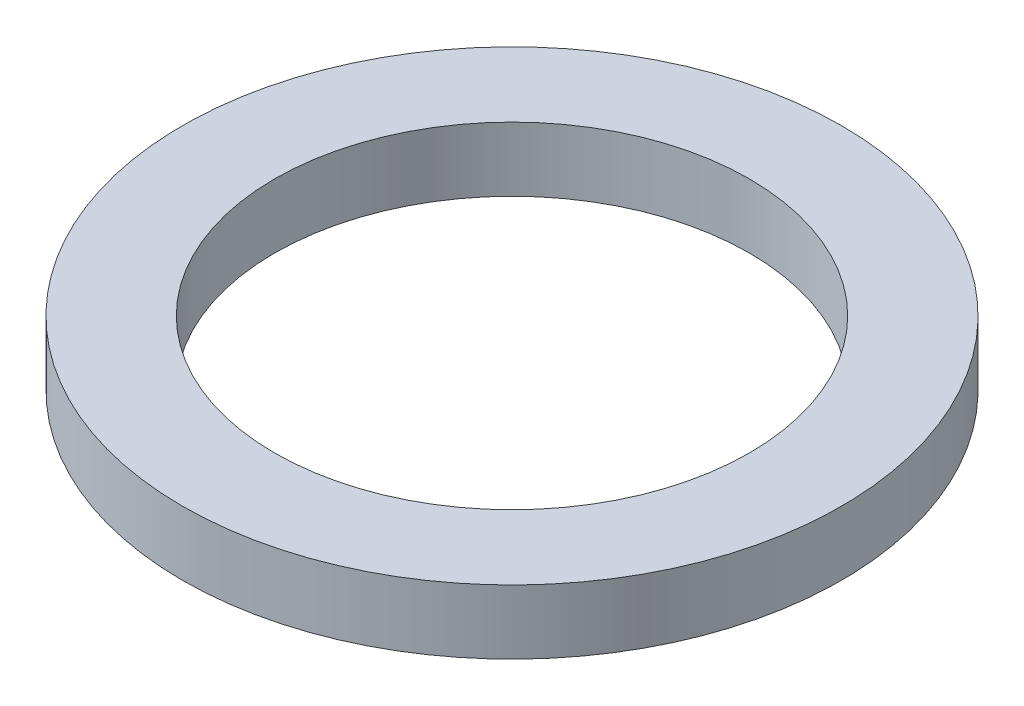
from build123d import *

# Parameters (mm, degrees)
SKETCH1_R           = 5.9
SKETCH1_R_2         = 4.25
BOSS_EXTRUDE1_DEPTH = 1.15


with BuildPart() as part:
    # Sketch1 → Boss-Extrude1 (new body)
    with BuildSketch(Plane(origin=(0, 0, 0), x_dir=(1, 0, 0), z_dir=(0, 1, 0))):
        with Locations(Location((0, 0, 0), (0, 0, 270))):
            Circle(SKETCH1_R)
        with Locations(Location((0, 0, 0), (0, 0, 270))):
            Circle(SKETCH1_R_2, mode=Mode.SUBTRACT)
    extrude(amount=BOSS_EXTRUDE1_DEPTH)


solid = part.part
